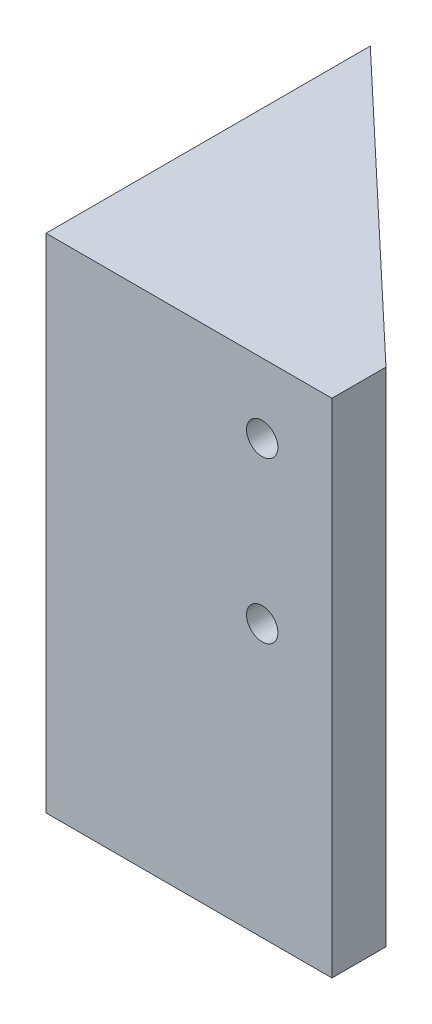
from build123d import *

# Parameters (mm, degrees)
SKETCH1_W                       = 20
SKETCH1_H                       = 46.45
BOSS_EXTRUDE1_DEPTH             = 5
BOSS_EXTRUDE4_REACH             = 27.776
BOSS_EXTRUDE4_DIRECTION_2_REACH = 27.776
SKETCH6_R                       = 1.45
CUT_EXTRUDE2_DEPTH              = 7.5


with BuildPart() as part:
    # Sketch1 → Boss-Extrude1 (new body)
    with BuildSketch(Plane.XY):
        Rectangle(SKETCH1_W, SKETCH1_H)
    extrude(amount=BOSS_EXTRUDE1_DEPTH)

    # Boss-Extrude4: up to this face of the body (flat: up to its plane)
    boss_extrude4_end = Plane(part.part.faces().sort_by_distance((0, 23.225, 2.5))[0])
    # Sketch4 → Boss-Extrude4 (add, up to the picked face)
    with BuildSketch(Plane(origin=(0, 0, 0), x_dir=(1, 0, 0), z_dir=(0, 1, 0)), mode=Mode.PRIVATE) as boss_extrude4_sk1:
        Polygon((3.55, -5), (-16.45, -5), (-16.45, 25), (10, 0), (10, -5), align=None)
    boss_extrude4_tool1 = split(extrude(boss_extrude4_sk1.sketch, amount=BOSS_EXTRUDE4_REACH, mode=Mode.PRIVATE), bisect_by=boss_extrude4_end, keep=Keep.BOTH, mode=Mode.PRIVATE)
    add(boss_extrude4_tool1.solids().sort_by(Axis((-6.37381, 0, -5.238095), (0, 1, 0)))[0])

    # Boss-Extrude4 direction 2: up to this face of the body (flat: up to its plane)
    boss_extrude4_direction_2_end = Plane(part.part.faces().sort_by_distance((0, -23.225, 2.5))[0])
    # Sketch4 → Boss-Extrude4 direction 2 (add, up to the picked face)
    with BuildSketch(Plane(origin=(0, 0, 0), x_dir=(1, 0, 0), z_dir=(0, 1, 0)), mode=Mode.PRIVATE) as boss_extrude4_direction_2_sk1:
        Polygon((3.55, -5), (-16.45, -5), (-16.45, 25), (10, 0), (10, -5), align=None)
    boss_extrude4_direction_2_tool1 = split(extrude(boss_extrude4_direction_2_sk1.sketch, amount=-BOSS_EXTRUDE4_DIRECTION_2_REACH, mode=Mode.PRIVATE), bisect_by=boss_extrude4_direction_2_end, keep=Keep.BOTH, mode=Mode.PRIVATE)
    add(boss_extrude4_direction_2_tool1.solids().sort_by(Axis((-6.37381, 0, -5.238095), (0, -1, 0)))[0])

    # Sketch6 → Cut-Extrude2 (cut)
    with BuildSketch(Plane.XY.offset(5)):
        with Locations((3.55, 16.775)):
            Circle(SKETCH6_R)
        with Locations((3.55, 1.935)):
            Circle(SKETCH6_R)
    extrude(amount=-CUT_EXTRUDE2_DEPTH, mode=Mode.SUBTRACT)


solid = part.part
